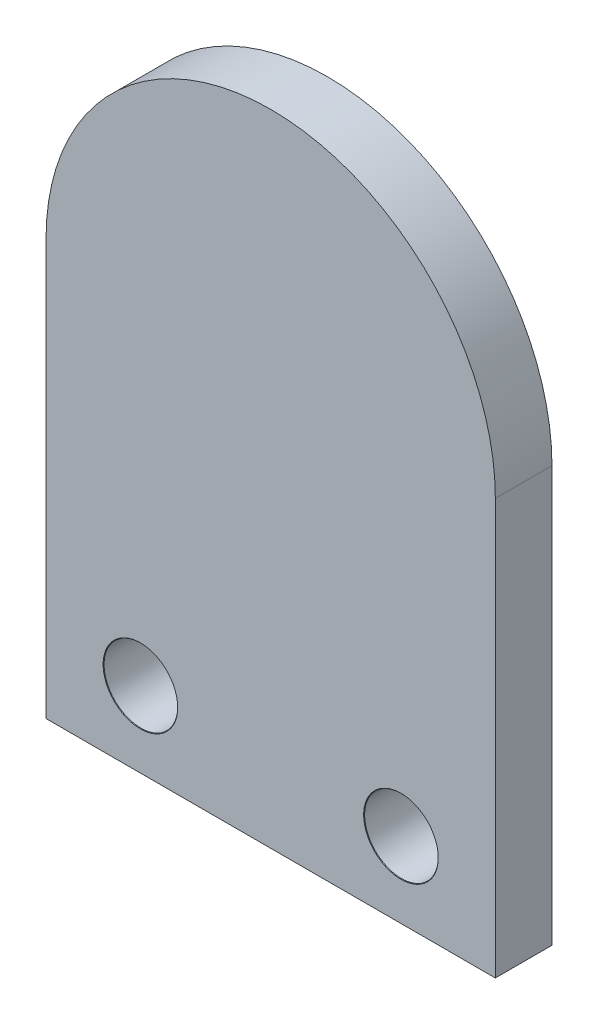
from build123d import *

# Parameters (mm, degrees)
BOSS_EXTRUDE1_DEPTH              = 3
SKETCH2_R                        = 1.95
BOSS_EXTRUDE2_DEPTH              = 3
M3_5_CLEARANCE_HOLE1_D           = 3.9
M3_5_CLEARANCE_HOLE1_CSINK_D     = 3.95
M3_5_CLEARANCE_HOLE1_CSINK_ANGLE = 90


with BuildPart() as part:
    # Sketch1 → Boss-Extrude1 (new body)
    with BuildSketch(Plane.XY):
        with BuildLine():
            Line((-11.9, 0), (-11.9, -22))
            Line((-11.9, -22), (11.9, -22))
            Line((11.9, -22), (11.9, 0))
            ThreePointArc((11.9, 0), (0, 11.9), (-11.9, 0))
        make_face()
    extrude(amount=BOSS_EXTRUDE1_DEPTH)

    # Sketch2 → Boss-Extrude2 (add)
    with BuildSketch(Plane(origin=(0, 0, 0), x_dir=(-1, 0, 0), z_dir=(0, 0, -1))):
        with Locations(Location((0, 6, 0), (0, 0, 180))):
            Circle(SKETCH2_R)
        with Locations(Location((6, 0, 0), (0, 0, 180))):
            Circle(SKETCH2_R)
        with Locations(Location((0, -6, 0), (0, 0, 180))):
            Circle(SKETCH2_R)
        with Locations(Location((-6, 0, 0), (0, 0, 180))):
            Circle(SKETCH2_R)
    extrude(amount=BOSS_EXTRUDE2_DEPTH)

    # M3.5 Clearance Hole1 (through all)
    with Locations(Plane.XY.offset(3)):
        with Locations((6.9, -18), (-6.9, -18)):
            CounterSinkHole(M3_5_CLEARANCE_HOLE1_D / 2, M3_5_CLEARANCE_HOLE1_CSINK_D / 2, counter_sink_angle=M3_5_CLEARANCE_HOLE1_CSINK_ANGLE)


solid = part.part
